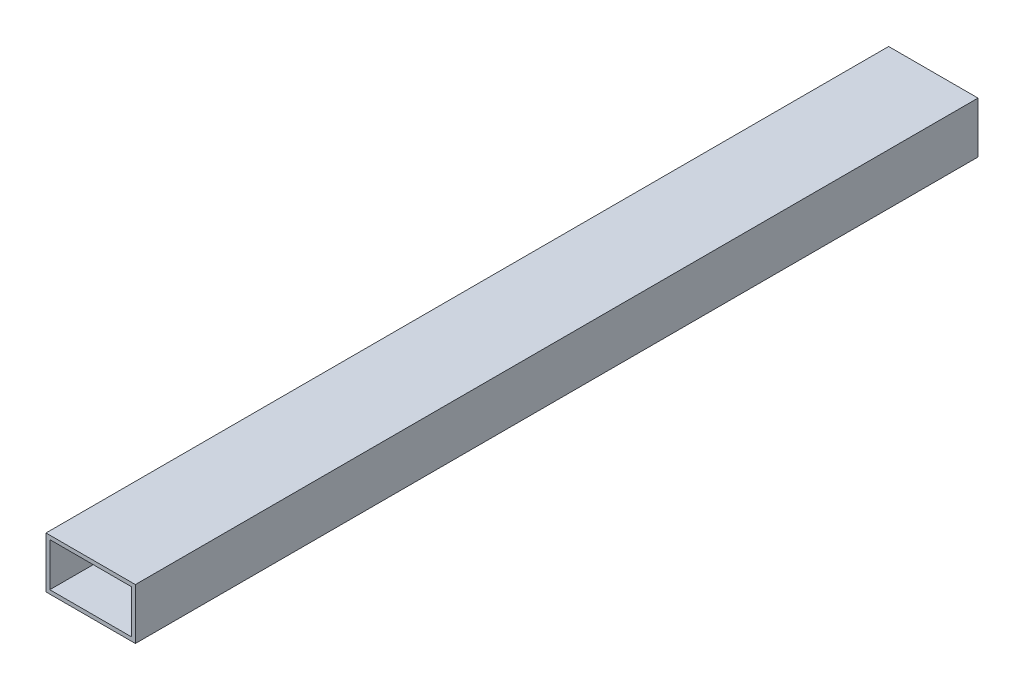
from build123d import *

# Parameters (mm, degrees)
ESQUISSE1_W        = 35
ESQUISSE1_H        = 20
ESQUISSE1_W_2      = 32
ESQUISSE1_H_2      = 17
BOSS_EXTRU_1_DEPTH = 330


with BuildPart() as part:
    # Esquisse1 → Boss.-Extru.1 (new body)
    with BuildSketch(Plane.XY):
        with Locations((17.5, 10)):
            Rectangle(ESQUISSE1_W, ESQUISSE1_H)
        with Locations((17.5, 10)):
            Rectangle(ESQUISSE1_W_2, ESQUISSE1_H_2, mode=Mode.SUBTRACT)
    extrude(amount=BOSS_EXTRU_1_DEPTH)


solid = part.part
